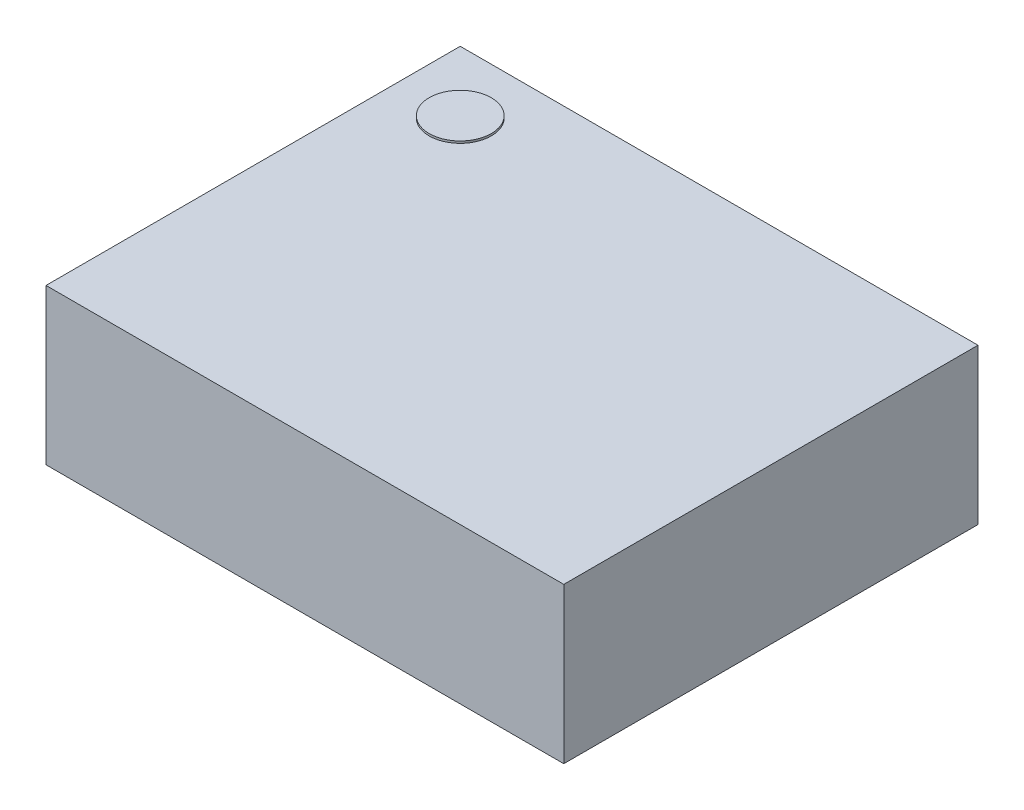
from build123d import *

# Parameters (mm, degrees)
SKETCH1_W           = 2.5
SKETCH1_H           = 2
BOSS_EXTRUDE1_DEPTH = 0.75
SKETCH2_R           = 0.15
BOSS_EXTRUDE2_DEPTH = 0.01


with BuildPart() as part:
    # Sketch1 → Boss-Extrude1 (new body)
    with BuildSketch(Plane(origin=(0, 0, 0), x_dir=(1, 0, 0), z_dir=(0, 1, 0))):
        with Locations((-17.201612903, 9.651612903)):
            Rectangle(SKETCH1_W, SKETCH1_H)
    extrude(amount=BOSS_EXTRUDE1_DEPTH)

    # Sketch2 → Boss-Extrude2 (add)
    with BuildSketch(Plane(origin=(0, 0.75, 0), x_dir=(1, 0, 0), z_dir=(0, 1, 0))):
        with Locations(Location((-18.151612903, 10.351612903, 0), (0, 0, 270))):
            Circle(SKETCH2_R)
    extrude(amount=BOSS_EXTRUDE2_DEPTH)


solid = part.part
